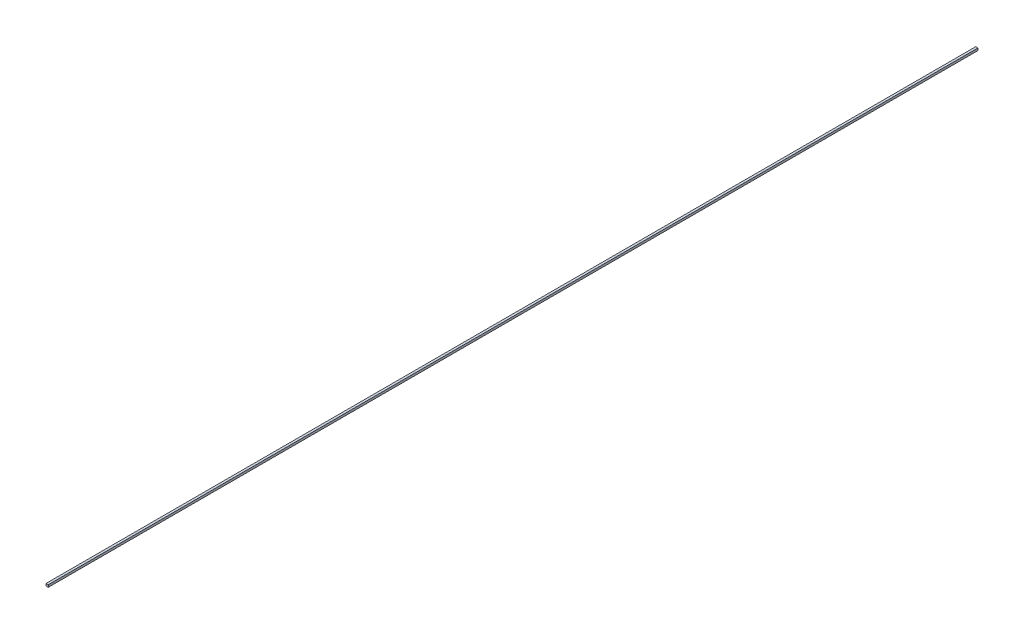
from build123d import *

# Parameters (mm, degrees)
SKETCH1_W           = 6
SKETCH1_H           = 6
BOSS_EXTRUDE1_DEPTH = 1234.094


with BuildPart() as part:
    # Sketch1 → Boss-Extrude1 (new body)
    with BuildSketch(Plane.XY):
        Rectangle(SKETCH1_W, SKETCH1_H)
    extrude(amount=BOSS_EXTRUDE1_DEPTH)

    # Mirror1: part across plane


with BuildPart() as part_1:
    add(part.part)
    add(part.part.mirror(Plane.XY))


solid = part_1.part
